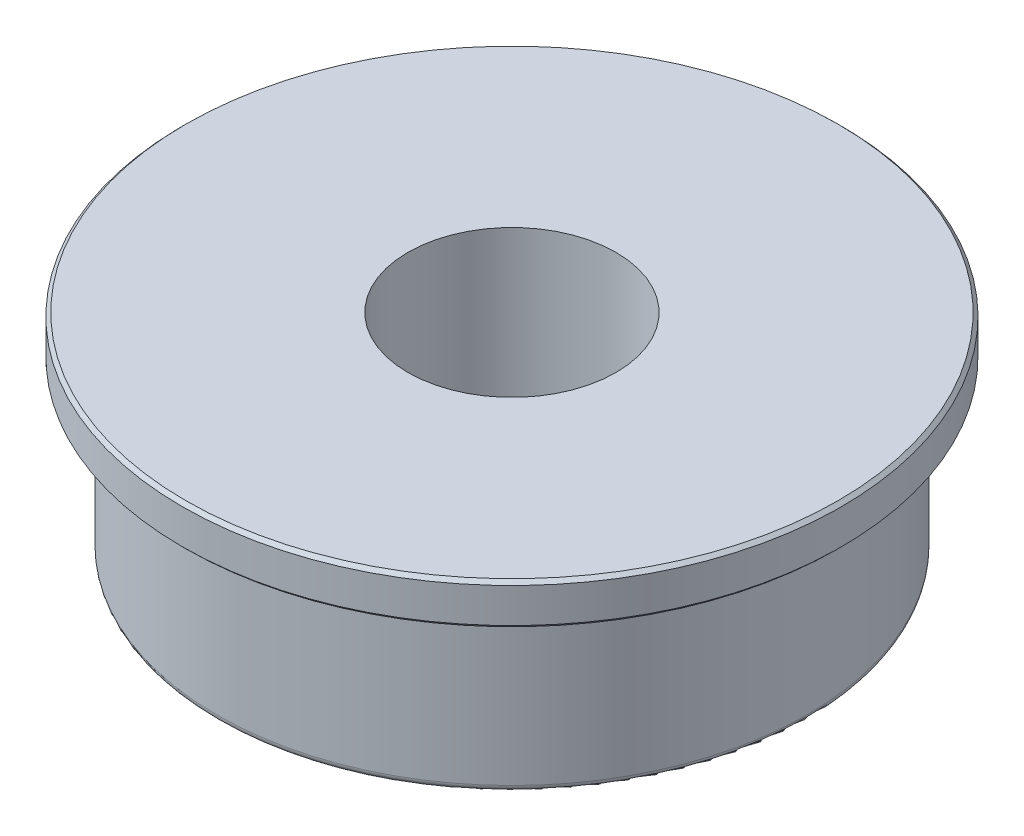
from build123d import *

# Parameters (mm, degrees)
SKETCH_1_R      = 8.5
SKETCH_1_R_2    = 3
EXTRUDE_1_DEPTH = 6
EXTRUDE_START   = -1.2
SKETCH_2_R      = 9.5
SKETCH_2_R_2    = 3
EXTRUDE_2_DEPTH = 1.2
FILLET_1_R      = 0.2
CHAMFER_1_SIZE  = 0.1


with BuildPart() as part:
    # 草图1 → 凸台-拉伸1 (new body)
    with BuildSketch(Plane(origin=(0, 0, 0), x_dir=(1, 0, 0), z_dir=(0, 1, 0))):
        with Locations(Location((0, 0, 0), (0, 0, 270))):
            Circle(SKETCH_1_R)
        with Locations(Location((0, 0, 0), (0, 0, 270))):
            Circle(SKETCH_1_R_2, mode=Mode.SUBTRACT)
    extrude(amount=EXTRUDE_1_DEPTH)

    # 草图2 → 凸台-拉伸2 (add)
    with BuildSketch(Plane(origin=(0, 6, 0), x_dir=(1, 0, 0), z_dir=(0, 1, 0)).offset(EXTRUDE_START)):
        with Locations(Location((0, 0, 0), (0, 0, 270))):
            Circle(SKETCH_2_R)
        with Locations(Location((0, 0, 0), (0, 0, 270))):
            Circle(SKETCH_2_R_2, mode=Mode.SUBTRACT)
    extrude(amount=EXTRUDE_2_DEPTH)

    # 圆角1
    fillet_1_edges = [part.edges().sort_by_distance(p)[0] for p in [
        (0, 0, -8.5),
    ]]
    fillet(fillet_1_edges, radius=FILLET_1_R)

    # 倒角1
    chamfer_1_edges = [part.edges().sort_by_distance(p)[0] for p in [
        (0, 6, -9.5),
        (0, 4.8, -9.5),
    ]]
    chamfer(chamfer_1_edges, length=CHAMFER_1_SIZE)


solid = part.part
